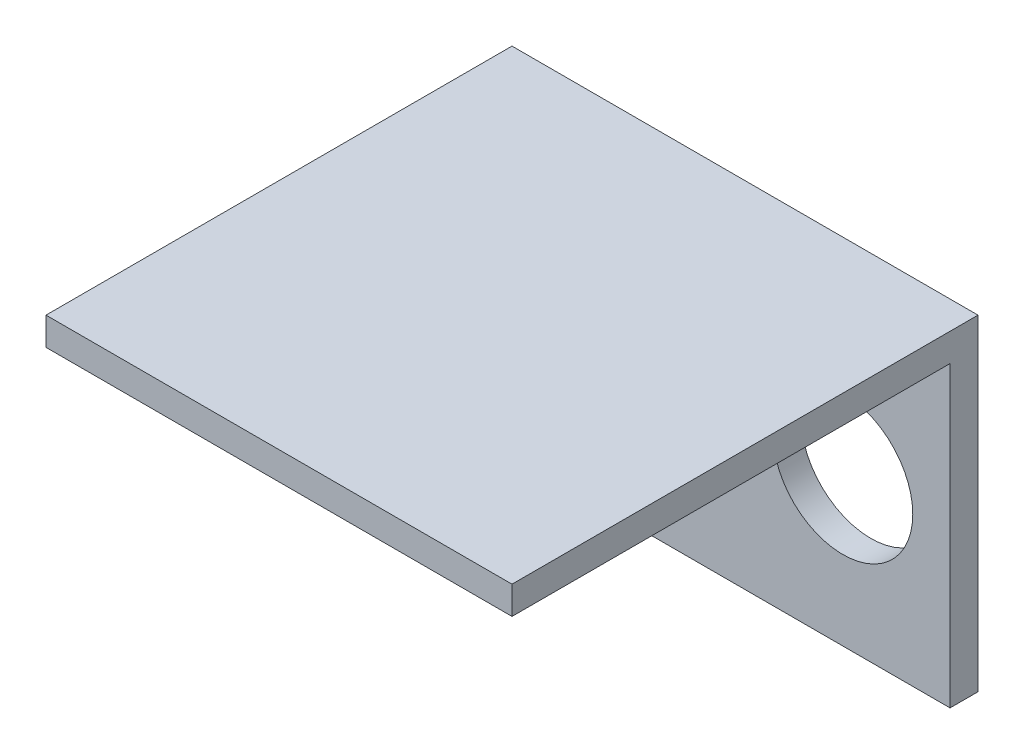
from build123d import *

# Parameters (mm, degrees)
ESBO_O2_W                = 50
ESBO_O2_H                = 50
RESSALTO_EXTRUS_O1_DEPTH = 3
ESBO_O4_W                = 50
ESBO_O4_H                = 3
RESSALTO_EXTRUS_O2_DEPTH = 32
ESBO_O6_R                = 7.5
CORTE_EXTRUS_O1_DEPTH    = 69.319814067


with BuildPart() as part:
    # Esboço2 → Ressalto-extrusão1 (new body)
    with BuildSketch(Plane(origin=(0, 0, 0), x_dir=(1, 0, 0), z_dir=(0, 1, 0))):
        with Locations((-12.876074165, -14.183267942)):
            Rectangle(ESBO_O2_W, ESBO_O2_H)
    extrude(amount=RESSALTO_EXTRUS_O1_DEPTH)

    # Esboço4 → Ressalto-extrusão2 (add)
    with BuildSketch(Plane(origin=(0, 0, 0), x_dir=(-1, 0, 0), z_dir=(0, -1, 0))):
        with Locations((12.876074165, 9.316732058)):
            Rectangle(ESBO_O4_W, ESBO_O4_H)
    extrude(amount=RESSALTO_EXTRUS_O2_DEPTH)

    # Esboço6 → Corte-extrusão1 (cut, through all)
    with BuildSketch(Plane.XY.offset(-7.816732058)):
        with Locations((-26.376074165, -16)):
            Circle(ESBO_O6_R)
        with Locations((0.623925835, -16)):
            Circle(ESBO_O6_R)
    extrude(amount=-CORTE_EXTRUS_O1_DEPTH, mode=Mode.SUBTRACT)


solid = part.part
